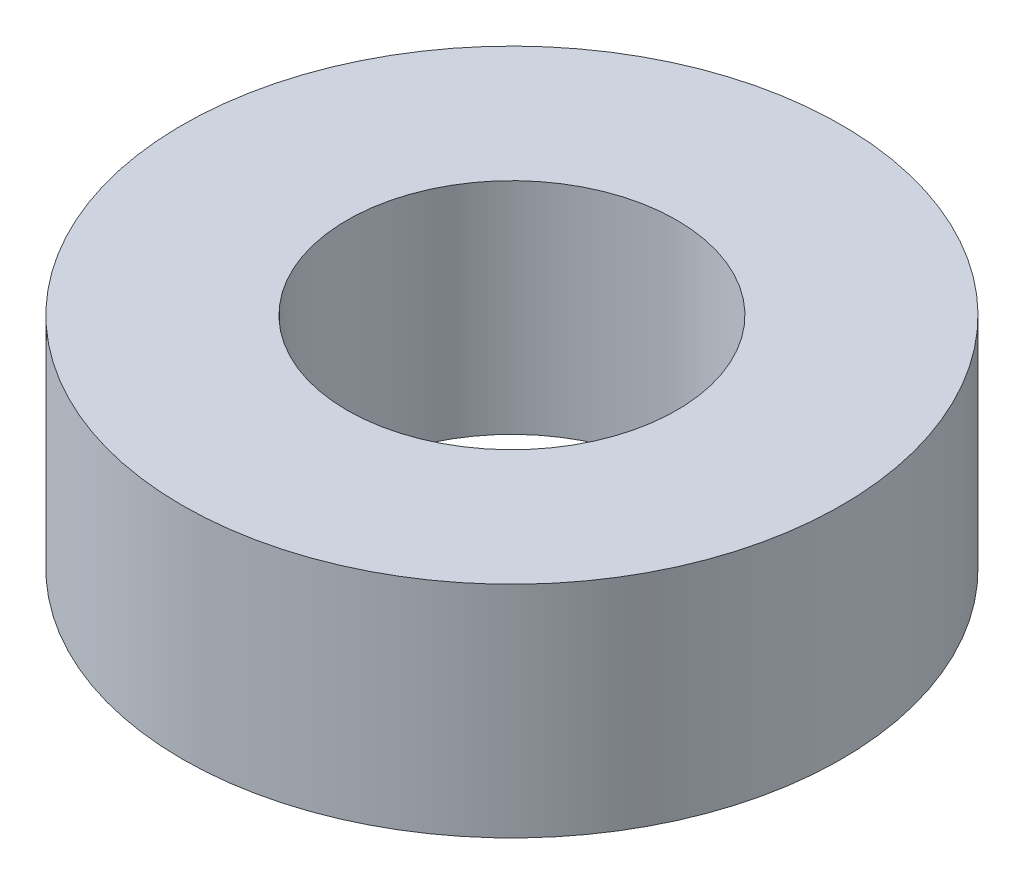
from build123d import *

# Parameters (mm, degrees)
SKETCH_1_R          = 30
EXTRUDE_1_DEPTH     = 20
SKETCH_2_R          = 15
CUT_EXTRUDE_1_DEPTH = 20


with BuildPart() as part:
    # Эскиз1 → Бобышка-Вытянуть1 (new body)
    with BuildSketch(Plane(origin=(0, 0, 0), x_dir=(1, 0, 0), z_dir=(0, 1, 0))):
        with Locations(Location((0, 0, 0), (0, 0, 270))):
            Circle(SKETCH_1_R)
    extrude(amount=EXTRUDE_1_DEPTH)

    # Эскиз2 → Вырез-Вытянуть1 (cut)
    with BuildSketch(Plane(origin=(0, 20, 0), x_dir=(1, 0, 0), z_dir=(0, 1, 0))):
        with Locations(Location((0, 0, 0), (0, 0, 270))):
            Circle(SKETCH_2_R)
    extrude(amount=-CUT_EXTRUDE_1_DEPTH, mode=Mode.SUBTRACT)


solid = part.part
